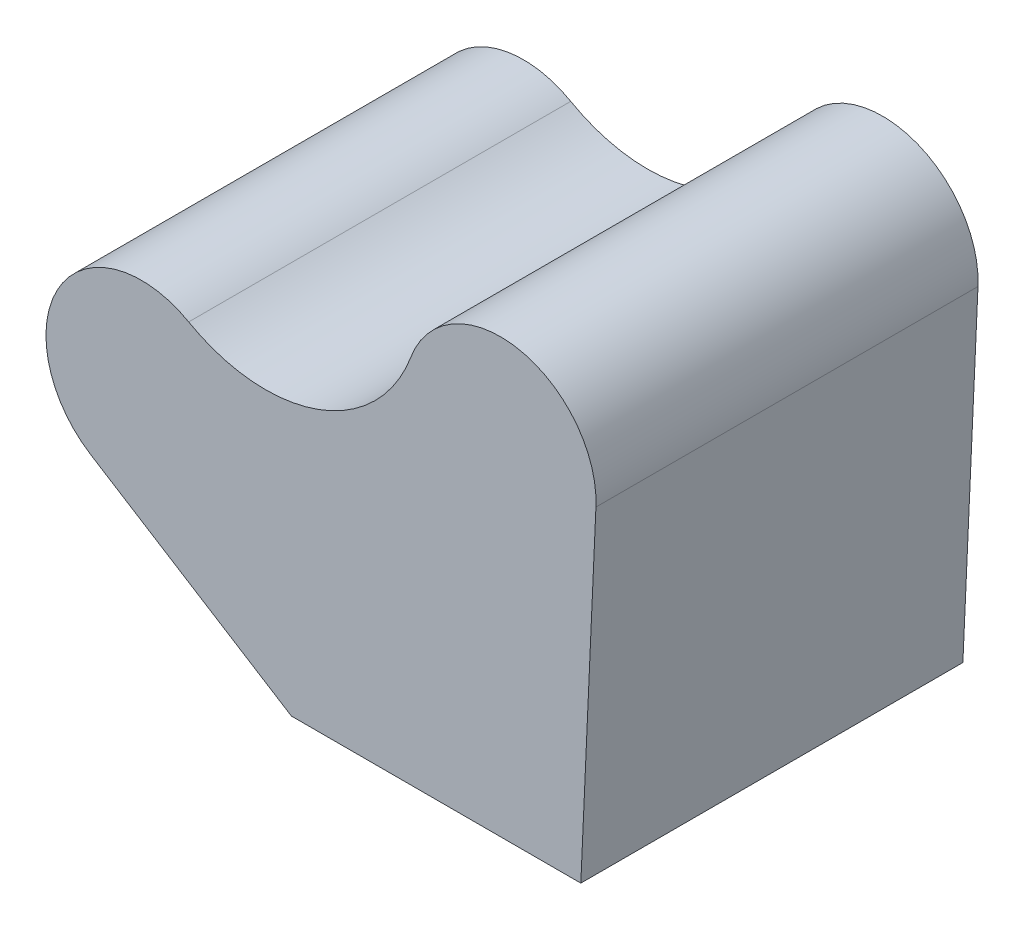
from build123d import *

# Parameters (mm, degrees)
EXTRUDE_1_DEPTH = 20


with BuildPart() as part:
    # 草图1 → 凸台-拉伸1 (new, symmetric)
    with BuildSketch(Plane.XY):
        with BuildLine():
            Line((47.577439338, 13.227810722), (45.99529172, -21.662716293))
            Line((45.99529172, -21.662716293), (15.689460366, -21.662716293))
            Line((15.689460366, -21.662716293), (-5.318631208, -8.468303377))
            ThreePointArc((-5.318631208, -8.468303377), (-8.583413456, 5.130790723), (4.940460041, 8.694357629))
            ThreePointArc((4.940460041, 8.694357629), (18.534857961, 7.551984283), (28.214467512, 17.165403581))
            ThreePointArc((28.214467512, 17.165403581), (39.580485947, 23.480235483), (47.577439338, 13.227810722))
        make_face()
    extrude(amount=EXTRUDE_1_DEPTH, both=True)


solid = part.part
